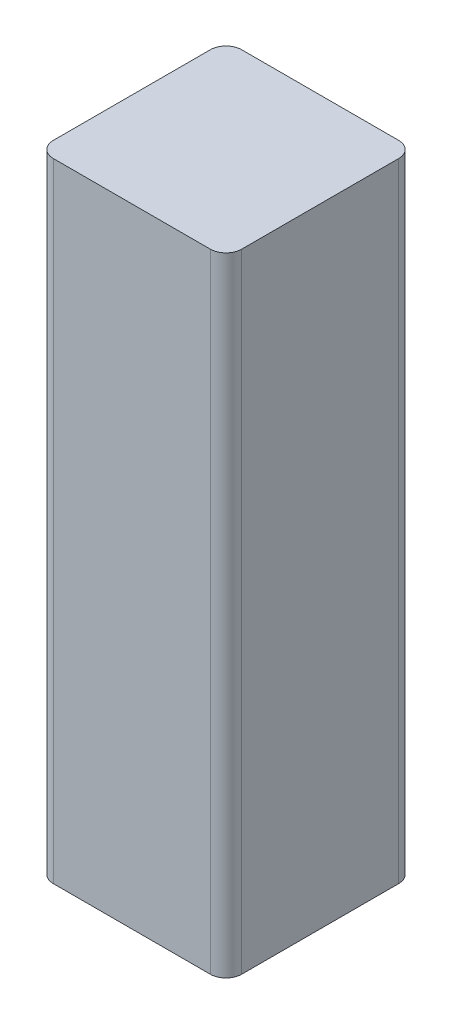
from build123d import *

# Parameters (mm, degrees)
SKETCH1_W           = 6
SKETCH1_H           = 6
BOSS_EXTRUDE1_DEPTH = 20
FILLET1_R           = 0.5


with BuildPart() as part:
    # Sketch1 → Boss-Extrude1 (new body)
    with BuildSketch(Plane(origin=(0, 0, 0), x_dir=(1, 0, 0), z_dir=(0, 1, 0))):
        Rectangle(SKETCH1_W, SKETCH1_H)
    extrude(amount=BOSS_EXTRUDE1_DEPTH)

    # Fillet1
    fillet1_edges = [part.edges().sort_by_distance(p)[0] for p in [
        (-3, 10, -3),
        (3, 10, -3),
        (3, 10, 3),
        (-3, 10, 3),
    ]]
    fillet(fillet1_edges, radius=FILLET1_R)


solid = part.part
